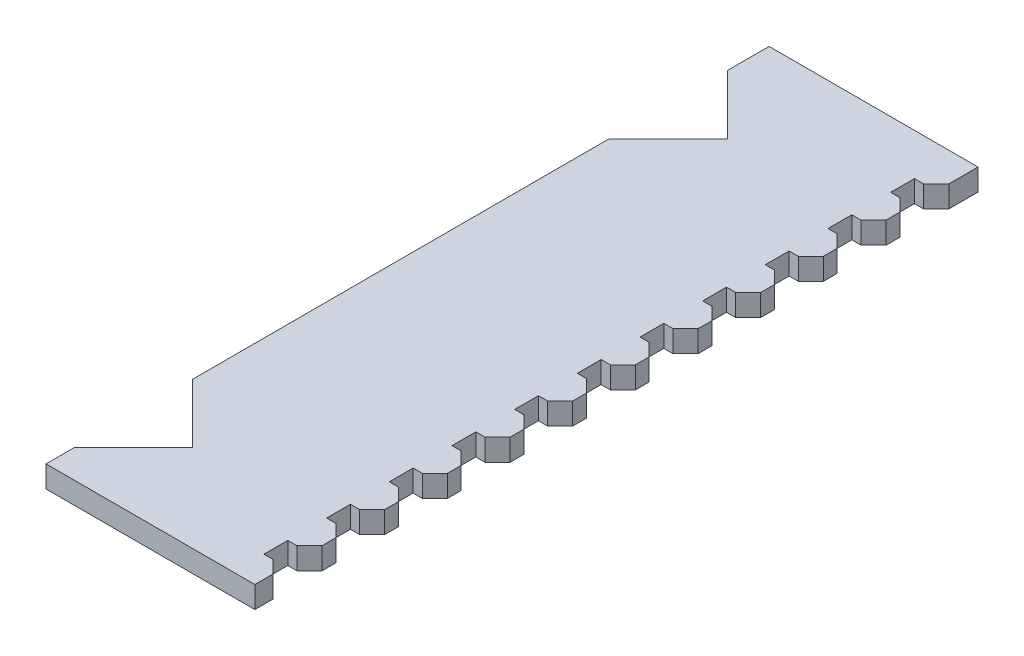
from build123d import *

# Parameters (mm, degrees)
SKETCH1_W                  = 50
SKETCH1_H                  = 173.07
BOSS_EXTRUDE1_DEPTH        = 5.2
CUT_EXTRUDE1_DEPTH         = 6
SKETCH4_W                  = 5.2
SKETCH4_H                  = 5.7
CUT_EXTRUDE2_DEPTH         = 6
CHAMFER1_SIZE              = 3
LPATTERN1_COUNT            = 11
LPATTERN1_PITCH            = 15
CHAMFER1_OF_LPATTERN1_SIZE = 3


with BuildPart() as part:
    # Sketch1 → Boss-Extrude1 (new body)
    with BuildSketch(Plane(origin=(0, 0, 0), x_dir=(1, 0, 0), z_dir=(0, 1, 0))):
        with Locations((25, 86.535)):
            Rectangle(SKETCH1_W, SKETCH1_H)
    extrude(amount=BOSS_EXTRUDE1_DEPTH)

    # Sketch2 → Cut-Extrude1 (cut)
    with BuildSketch(Plane(origin=(0, 5.2, 0), x_dir=(1, 0, 0), z_dir=(0, 1, 0))):
        Polygon((0, 134.785728753), (14.142135624, 148.927864376), (0, 163.07), align=None)
        Polygon((14.142135624, 20.927864376), (0, 6.785728753), (0, 35.07), align=None)
    extrude(amount=-CUT_EXTRUDE1_DEPTH, mode=Mode.SUBTRACT)

    # Sketch4 → Cut-Extrude2 (cut)
    with BuildSketch(Plane(origin=(0, 5.2, 0), x_dir=(1, 0, 0), z_dir=(0, 1, 0))):
        with Locations((47.4, 160.22)):
            Rectangle(SKETCH4_W, SKETCH4_H)
    cut_extrude2 = extrude(amount=-CUT_EXTRUDE2_DEPTH, mode=Mode.SUBTRACT)

    # Chamfer1
    chamfer1_edges = [part.edges().sort_by_distance(p)[0] for p in [
        (50, 2.6, -163.07),
        (50, 2.6, -157.37),
    ]]
    chamfer(chamfer1_edges, length=CHAMFER1_SIZE)

    # LPattern1: Cut-Extrude2 ×11
    with Locations(*[(0, 0, i * LPATTERN1_PITCH) for i in range(1, LPATTERN1_COUNT)]):
        add(cut_extrude2, mode=Mode.SUBTRACT)

    # Chamfer1 of LPattern1
    chamfer1_of_lpattern1_edges = [part.edges().sort_by_distance(p)[0] for p in [
        (50, 2.6, -148.07),
        (50, 2.6, -142.37),
        (50, 2.6, -133.07),
        (50, 2.6, -127.37),
        (50, 2.6, -118.07),
        (50, 2.6, -112.37),
        (50, 2.6, -103.07),
        (50, 2.6, -97.37),
        (50, 2.6, -88.07),
        (50, 2.6, -82.37),
        (50, 2.6, -73.07),
        (50, 2.6, -67.37),
        (50, 2.6, -58.07),
        (50, 2.6, -52.37),
        (50, 2.6, -43.07),
        (50, 2.6, -37.37),
        (50, 2.6, -28.07),
        (50, 2.6, -22.37),
        (50, 2.6, -13.07),
        (50, 2.6, -7.37),
    ]]
    chamfer(chamfer1_of_lpattern1_edges, length=CHAMFER1_OF_LPATTERN1_SIZE)


solid = part.part
